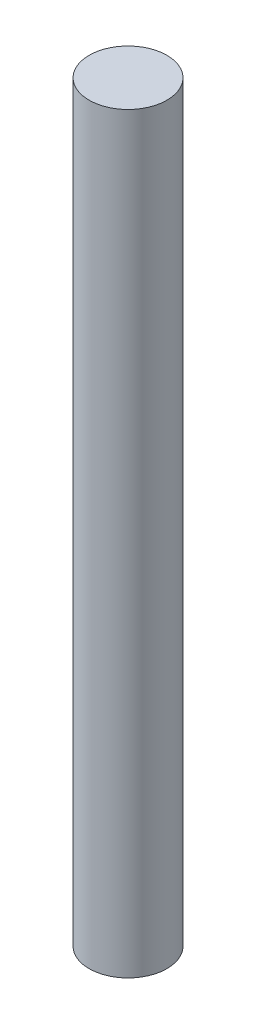
from build123d import *

# Parameters (mm, degrees)
SKETCH1_R           = 3
BOSS_EXTRUDE1_DEPTH = 58


with BuildPart() as part:
    # Sketch1 → Boss-Extrude1 (new body)
    with BuildSketch(Plane(origin=(0, 0, 0), x_dir=(1, 0, 0), z_dir=(0, 1, 0))):
        with Locations(Location((0, 0, 0), (0, 0, 90))):
            Circle(SKETCH1_R)
    extrude(amount=BOSS_EXTRUDE1_DEPTH)


solid = part.part
